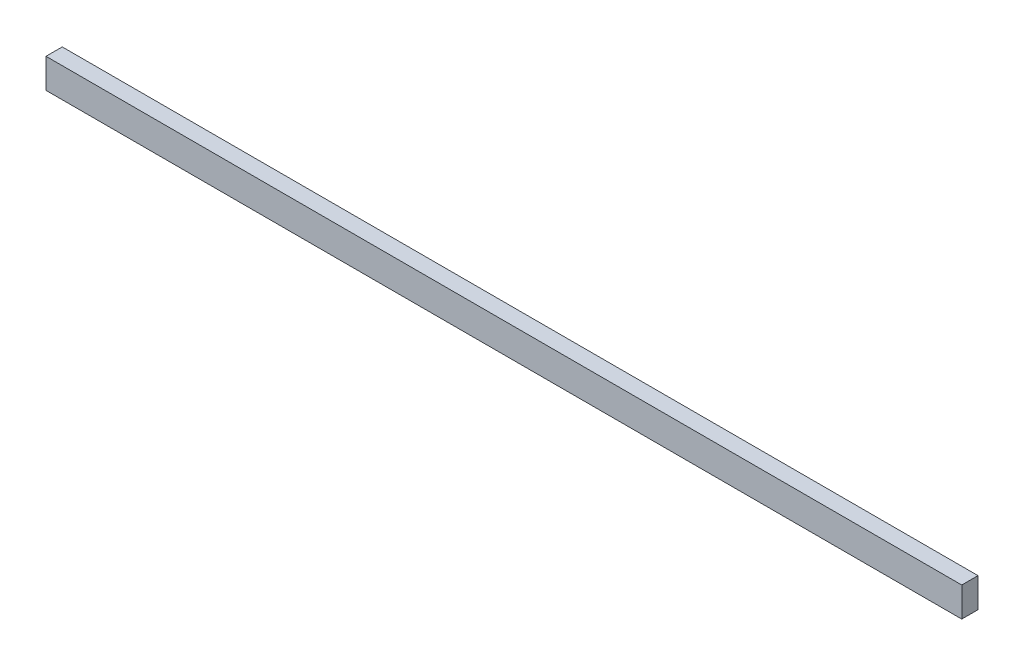
from build123d import *

# Parameters (mm, degrees)
ESQUISSE1_W        = 310
ESQUISSE1_H        = 10
BOSS_EXTRU_1_DEPTH = 5.5


with BuildPart() as part:
    # Esquisse1 → Boss.-Extru.1 (new body)
    with BuildSketch(Plane.XY):
        with Locations((-155, 5)):
            Rectangle(ESQUISSE1_W, ESQUISSE1_H)
    extrude(amount=BOSS_EXTRU_1_DEPTH)


solid = part.part
